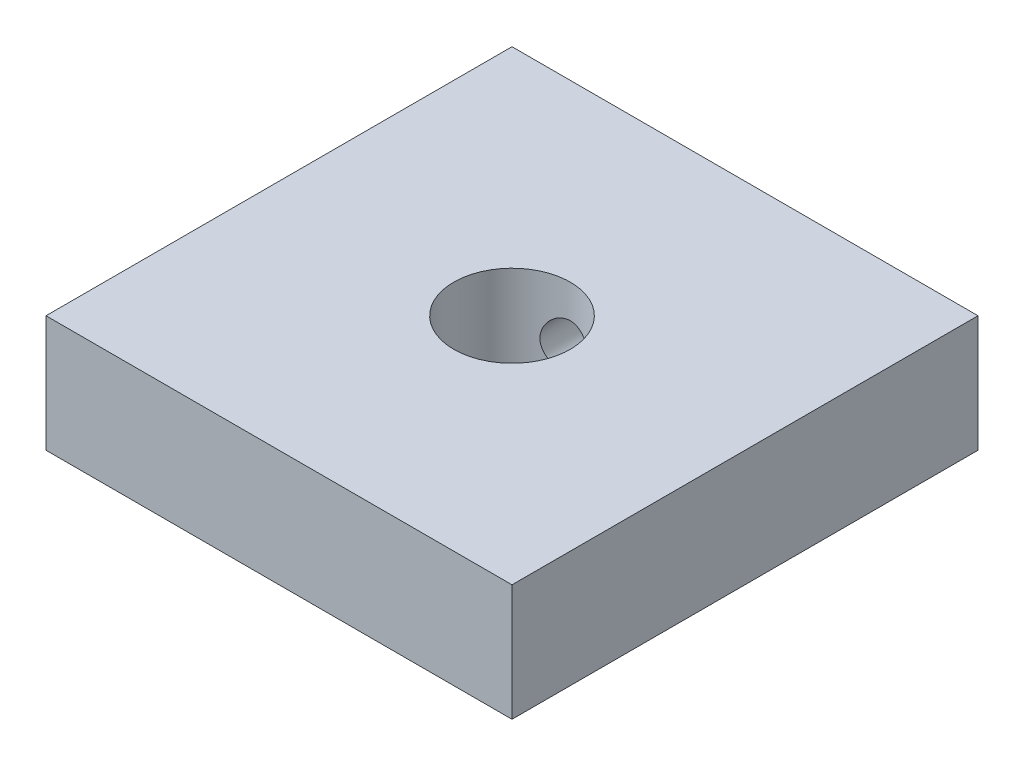
from build123d import *

# Parameters (mm, degrees)
SKETCH1_W                  = 25.4
SKETCH1_H                  = 25.4
BOSS_EXTRUDE1_DEPTH        = 6.35
SKETCH2_R                  = 3.175
CUT_EXTRUDE1_DEPTH         = 20.05
F_6_32_TAPPED_HOLE1_REACH  = 31.099
F_6_32_TAPPED_HOLE1_BORE_R = 1.35255


with BuildPart() as part:
    # Sketch1 → Boss-Extrude1 (new body)
    with BuildSketch(Plane(origin=(0, 0, 0), x_dir=(1, 0, 0), z_dir=(0, 1, 0))):
        Rectangle(SKETCH1_W, SKETCH1_H)
    extrude(amount=BOSS_EXTRUDE1_DEPTH)

    # Sketch2 → Cut-Extrude1 (cut, through all)
    with BuildSketch(Plane(origin=(0, 6.35, 0), x_dir=(1, 0, 0), z_dir=(0, 1, 0))):
        with Locations(Location((0, 0, 0), (0, 0, 270))):
            Circle(SKETCH2_R)
    extrude(amount=-CUT_EXTRUDE1_DEPTH, mode=Mode.SUBTRACT)

    # #6-32 Tapped Hole1 bore → #6-32 Tapped Hole1 (cut, up to next)
    with BuildSketch(Plane(origin=(0, 0, -12.7), x_dir=(-1, 0, 0), z_dir=(0, 0, -1)), mode=Mode.PRIVATE) as f_6_32_tapped_hole1_sk1:
        with Locations((0, 3.175)):
            Circle(F_6_32_TAPPED_HOLE1_BORE_R)
    f_6_32_tapped_hole1_tool1 = extrude(f_6_32_tapped_hole1_sk1.sketch, amount=-F_6_32_TAPPED_HOLE1_REACH, mode=Mode.PRIVATE) & part.part
    add(f_6_32_tapped_hole1_tool1.solids().sort_by_distance((0, 3.175, -12.7))[0], mode=Mode.SUBTRACT)


solid = part.part
